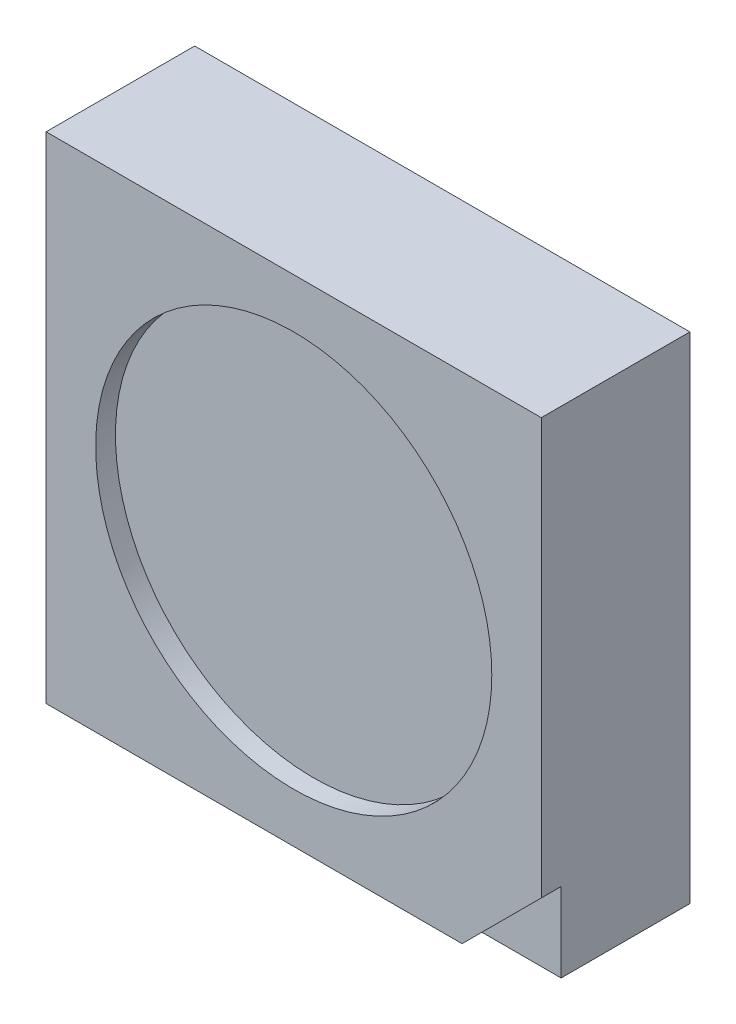
from build123d import *

# Parameters (mm, degrees)
SKETCH_1_W          = 5
SKETCH_1_H          = 5
EXTRUDE_1_DEPTH     = 1.5
SKETCH_2_R          = 2
CUT_EXTRUDE_1_DEPTH = 0.2


with BuildPart() as part:
    # Эскиз1 → Бобышка-Вытянуть1 (new body)
    with BuildSketch(Plane.XY):
        Rectangle(SKETCH_1_W, SKETCH_1_H)
    extrude(amount=EXTRUDE_1_DEPTH)

    # Эскиз2 → Вырез-Вытянуть1 (cut)
    with BuildSketch(Plane.XY.offset(1.5)):
        Circle(SKETCH_2_R)
        Polygon((2.5, -2.5), (1.7, -2.5), (2.5, -1.7), align=None)
    extrude(amount=-CUT_EXTRUDE_1_DEPTH, mode=Mode.SUBTRACT)


solid = part.part
